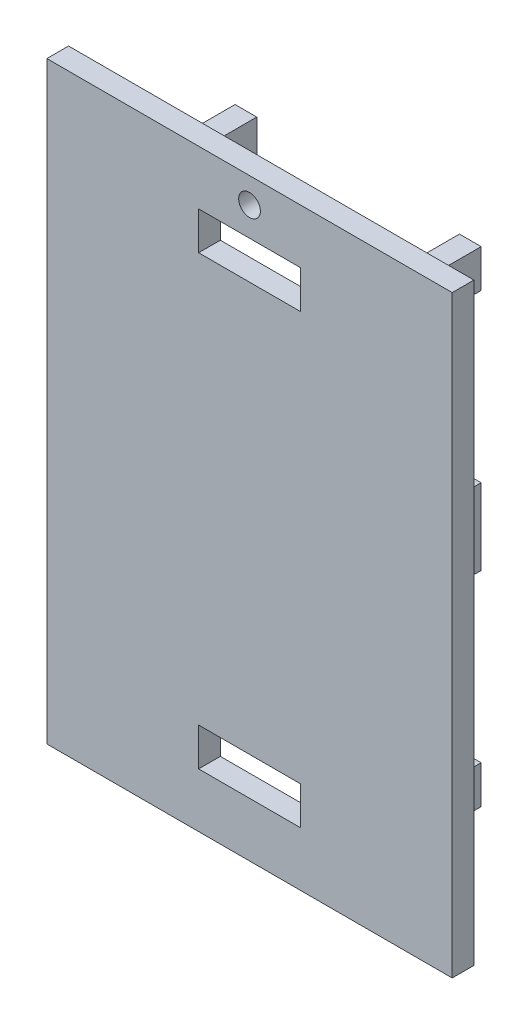
from build123d import *

# Parameters (mm, degrees)
SKETCH_1_W          = 48
SKETCH_1_H          = 67
EXTRUDE_2_DEPTH     = 3
SKETCH_3_W          = 3
SKETCH_3_H          = 67
EXTRUDE_3_DEPTH     = 12
SKETCH_4_R          = 1.35
SKETCH_4_W          = 12
SKETCH_4_H          = 23
CUT_EXTRUDE_1_DEPTH = 65
SKETCH_5_W          = 18.288137738
SKETCH_5_H          = 10.5
CUT_EXTRUDE_2_DEPTH = 65
SKETCH_6_W          = 3.5
SKETCH_6_H          = 67
CUT_EXTRUDE_3_DEPTH = 65
FILLET_1_R          = 3
SKETCH_7_W          = 56
SKETCH_7_H          = 82
EXTRUDE_4_DEPTH     = 3
SKETCH_9_W          = 14.065102052
SKETCH_9_H          = 5.25
CUT_EXTRUDE_4_DEPTH = 3
SKETCH_10_R         = 1.5
CUT_EXTRUDE_5_DEPTH = 3


with BuildPart() as part:
    # 草图1 → 凸台-拉伸2 (new body)
    with BuildSketch(Plane.XY):
        Rectangle(SKETCH_1_W, SKETCH_1_H)
    extrude(amount=EXTRUDE_2_DEPTH)

    # 草图3 → 凸台-拉伸3 (add)
    with BuildSketch(Plane(origin=(0, 0, 0), x_dir=(-1, 0, 0), z_dir=(0, 0, -1))):
        with Locations((-15.5, 0)):
            Rectangle(SKETCH_3_W, SKETCH_3_H)
        with Locations((15.5, 0)):
            Rectangle(SKETCH_3_W, SKETCH_3_H)
    extrude(amount=EXTRUDE_3_DEPTH)

    # 草图4 → 切除-拉伸1 (cut)
    with BuildSketch(Plane(origin=(17, 0, 0), x_dir=(0, 0, -1), z_dir=(1, 0, 0))):
        with Locations(Location((6, 2.5, 0), (0, 0, 270))):
            Circle(SKETCH_4_R)
        with Locations(Location((6, 30, 0), (0, 0, 270))):
            Circle(SKETCH_4_R)
        with Locations(Location((6, -2.5, 0), (0, 0, 270))):
            Circle(SKETCH_4_R)
        with Locations(Location((6, -30, 0), (0, 0, 270))):
            Circle(SKETCH_4_R)
        with Locations((6, -16.75)):
            Rectangle(SKETCH_4_W, SKETCH_4_H)
        with Locations((6, 16.75)):
            Rectangle(SKETCH_4_W, SKETCH_4_H)
    extrude(amount=-CUT_EXTRUDE_1_DEPTH, mode=Mode.SUBTRACT)

    # 草图5 → 切除-拉伸2 (cut)
    with BuildSketch(Plane(origin=(0, 0, 0), x_dir=(-1, 0, 0), z_dir=(0, 0, -1))):
        Rectangle(SKETCH_5_W, SKETCH_5_H)
    extrude(amount=-CUT_EXTRUDE_2_DEPTH, mode=Mode.SUBTRACT)

    # 草图6 → 切除-拉伸3 (cut)
    with BuildSketch(Plane(origin=(0, 0, 0), x_dir=(-1, 0, 0), z_dir=(0, 0, -1))):
        with Locations((22.25, 0)):
            Rectangle(SKETCH_6_W, SKETCH_6_H)
        with Locations((-22.25, 0)):
            Rectangle(SKETCH_6_W, SKETCH_6_H)
    extrude(amount=-CUT_EXTRUDE_3_DEPTH, mode=Mode.SUBTRACT)

    # 圆角1
    fillet_1_edges = [part.edges().sort_by_distance(p)[0] for p in [
        (20.5, 33.5, 1.5),
        (20.5, -33.5, 1.5),
        (-20.5, -33.5, 1.5),
        (-20.5, 33.5, 1.5),
    ]]
    fillet(fillet_1_edges, radius=FILLET_1_R)

    # 草图7 → 凸台-拉伸4 (add)
    with BuildSketch(Plane.XY.offset(3)):
        Rectangle(SKETCH_7_W, SKETCH_7_H)
    extrude(amount=-EXTRUDE_4_DEPTH)

    # 草图9 → 切除-拉伸4 (cut)
    with BuildSketch(Plane(origin=(0, 0, 0), x_dir=(-1, 0, 0), z_dir=(0, 0, -1))):
        with Locations((0, 30.875)):
            Rectangle(SKETCH_9_W, SKETCH_9_H)
        Polygon((0, -28.25), (-7.032551026, -28.25), (-7.032551026, -33.5), (7.032551026, -33.5), (7.032551026, -28.25), align=None)
    extrude(amount=-CUT_EXTRUDE_4_DEPTH, mode=Mode.SUBTRACT)

    # 草图10 → 切除-拉伸5 (cut)
    with BuildSketch(Plane.XY.offset(3)):
        with Locations((0, 37.483485188)):
            Circle(SKETCH_10_R)
    extrude(amount=-CUT_EXTRUDE_5_DEPTH, mode=Mode.SUBTRACT)


solid = part.part
